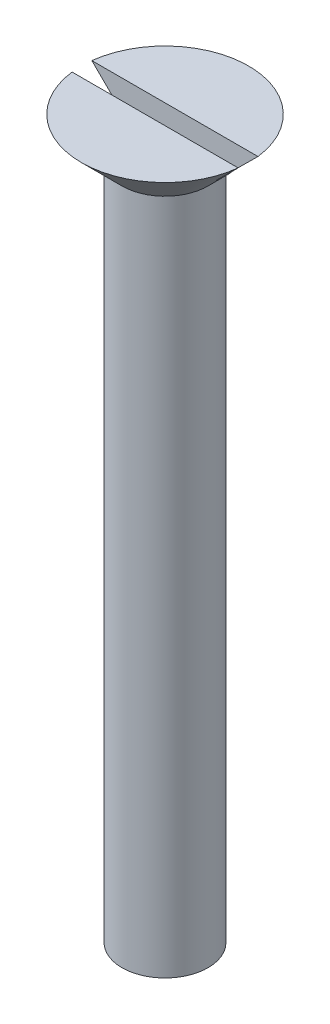
from build123d import *

# Parameters (mm, degrees)
CUT_EXTRUDE1_DEPTH      = 18.720089357
CUT_EXTRUDE1_DEPTH_BACK = 18.720089357
SKETCH2_W               = 0.689241478
SKETCH2_H               = 1.600251789


with BuildPart() as part:
    # Sketch1 → Revolve1 (revolve)
    with BuildSketch(Plane.XY, mode=Mode.PRIVATE) as revolve1_sk:
        Polygon((0, -17.234160421), (-1.5, -17.234160421), (-1.5, 6.351626016), (-2.914213562, 7.765839579), (0, 7.765839579), align=None)
    revolve(revolve1_sk.sketch.rotate(Axis((0, 17.327235772, 0), (0, -1, 0)), 270), axis=Axis((0, 17.327235772, 0), (0, -1, 0)))

    # Sketch2 → Cut-Extrude1 (cut, two sides: drawn at the far end of the back side and taken through both)
    with BuildSketch(Plane(origin=(0, 0, 0), x_dir=(0, 0, -1), z_dir=(1, 0, 0)).offset(-CUT_EXTRUDE1_DEPTH_BACK)):
        with Locations((0, 7.765839579)):
            Rectangle(SKETCH2_W, SKETCH2_H)
    extrude(amount=CUT_EXTRUDE1_DEPTH + CUT_EXTRUDE1_DEPTH_BACK, mode=Mode.SUBTRACT)


solid = part.part
